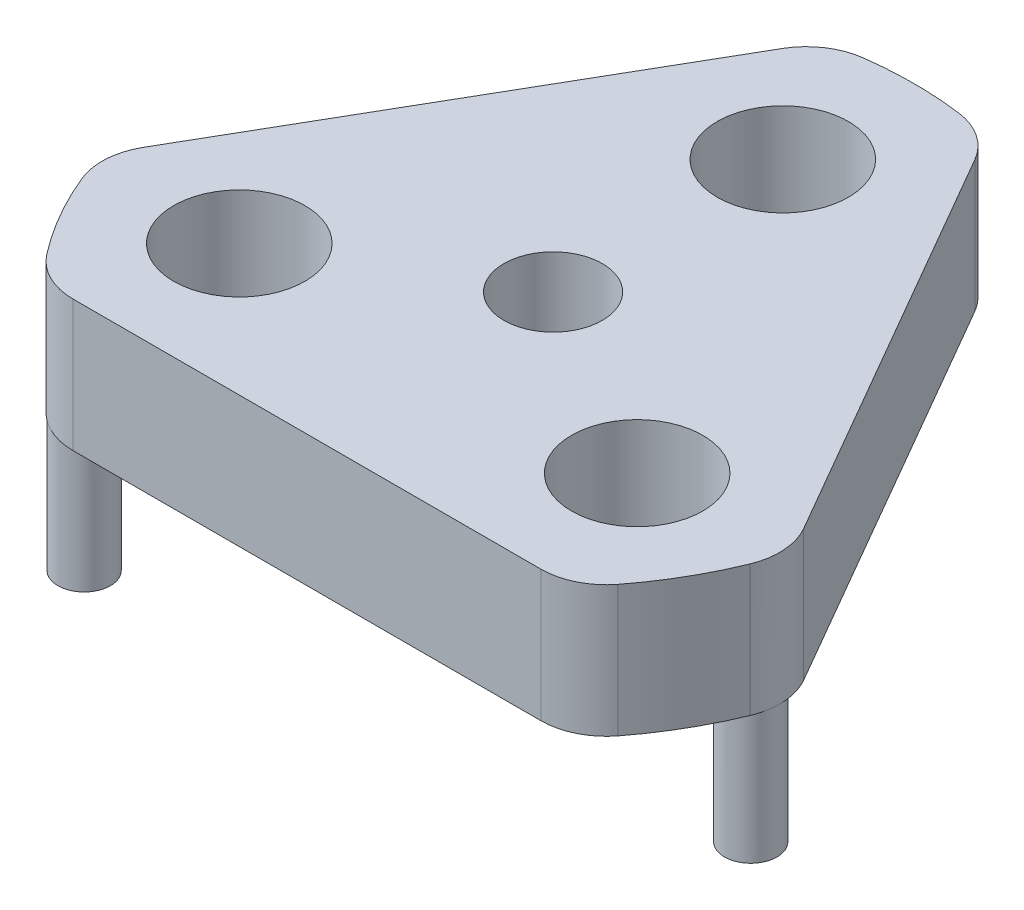
from build123d import *

# Parameters (mm, degrees)
CROQUIS1_R              = 5
CROQUIS1_R_2            = 3.75
SALIENTE_EXTRUIR3_DEPTH = 10
REDONDEO3_R             = 5
CROQUIS3_R              = 2
SALIENTE_EXTRUIR4_DEPTH = 10


with BuildPart() as part:
    # Croquis1 → Saliente-Extruir3 (new body)
    # profile 1 of 5: a face of its own
    with BuildSketch(Plane(origin=(0, 0, 0), x_dir=(1, 0, 0), z_dir=(0, 1, 0))):
        with BuildLine():
            ThreePointArc((6.179553234, 26.796699831), (0, 27.5), (-6.179553234, 26.796699831))
            Line((-6.179553234, 26.796699831), (-26.296399408, -8.046699831))
            ThreePointArc((-26.296399408, -8.046699831), (-23.815698604, -13.75), (-20.116846174, -18.75))
            Line((-20.116846174, -18.75), (20.116846174, -18.75))
            ThreePointArc((20.116846174, -18.75), (23.815698604, -13.75), (26.296399408, -8.046699831))
            Line((26.296399408, -8.046699831), (6.179553234, 26.796699831))
        make_face()
        with Locations(Location((-15.155444566, -8.75, 0), (0, 0, 270))):
            Circle(CROQUIS1_R, mode=Mode.SUBTRACT)
        with Locations(Location((15.155444566, -8.75, 0), (0, 0, 270))):
            Circle(CROQUIS1_R, mode=Mode.SUBTRACT)
        with BuildLine():
            ThreePointArc((0, 7.5), (2.053290038, 7.406507449), (3.995190528, 8.080127019))
            ThreePointArc((3.995190528, 8.080127019), (1.58501754, 10.938896501), (-1.666208496, 12.785792829))
            ThreePointArc((-1.666208496, 12.785792829), (-4.714207171, 19.166208496), (1.666208496, 22.214207171))
            ThreePointArc((1.666208496, 22.214207171), (7.977102724, 18.629231149), (12.655444566, 13.080127019))
            Line((12.655444566, 13.080127019), (17.655444566, 4.419872981))
            Line((17.655444566, 4.419872981), (8.995190528, -0.580127019))
            ThreePointArc((8.995190528, -0.580127019), (7.440868623, -1.92505239), (6.495190528, -3.75))
            ThreePointArc((6.495190528, -3.75), (0, -6.171567416), (-6.495190528, -3.75))
            ThreePointArc((-6.495190528, -3.75), (-5.344734164, 3.085783708), (0, 7.5))
        make_face(mode=Mode.SUBTRACT)
    # profile 2 of 5: a face of its own
    with BuildSketch(Plane(origin=(0, 0, 0), x_dir=(1, 0, 0), z_dir=(0, 1, 0))):
        with BuildLine():
            ThreePointArc((0, 7.5), (5.344734164, 3.085783708), (6.495190528, -3.75))
            ThreePointArc((6.495190528, -3.75), (0, -6.171567416), (-6.495190528, -3.75))
            ThreePointArc((-6.495190528, -3.75), (-5.344734164, 3.085783708), (0, 7.5))
        make_face()
        with Locations(Location((0, 0, 0), (0, 0, 270))):
            Circle(CROQUIS1_R_2, mode=Mode.SUBTRACT)
    # profile 3 of 5: a face of its own
    with BuildSketch(Plane(origin=(0, 0, 0), x_dir=(1, 0, 0), z_dir=(0, 1, 0))):
        with BuildLine():
            ThreePointArc((8.995190528, -0.580127019), (7.440868623, -1.92505239), (6.495190528, -3.75))
            ThreePointArc((6.495190528, -3.75), (5.344734164, 3.085783708), (0, 7.5))
            ThreePointArc((0, 7.5), (2.053290038, 7.406507449), (3.995190528, 8.080127019))
            Line((3.995190528, 8.080127019), (8.995190528, -0.580127019))
        make_face()
    # profile 4 of 5: a face of its own
    with BuildSketch(Plane(origin=(0, 0, 0), x_dir=(1, 0, 0), z_dir=(0, 1, 0))):
        Polygon((17.655444566, 4.419872981), (8.995190528, -0.580127019), (3.995190528, 8.080127019), (12.655444566, 13.080127019), align=None)
    # profile 5 of 5: a face of its own
    with BuildSketch(Plane(origin=(0, 0, 0), x_dir=(1, 0, 0), z_dir=(0, 1, 0))):
        with BuildLine():
            ThreePointArc((-1.666208496, 12.785792829), (1.58501754, 10.938896501), (3.995190528, 8.080127019))
            Line((3.995190528, 8.080127019), (12.655444566, 13.080127019))
            ThreePointArc((12.655444566, 13.080127019), (7.977102724, 18.629231149), (1.666208496, 22.214207171))
            ThreePointArc((1.666208496, 22.214207171), (4.082342617, 20.386949733), (5, 17.5))
            ThreePointArc((5, 17.5), (2.886949733, 13.417657383), (-1.666208496, 12.785792829))
        make_face()
    extrude(amount=SALIENTE_EXTRUIR3_DEPTH)

    # Redondeo3
    redondeo3_edges = [part.edges().sort_by_distance(p)[0] for p in [
        (-20.116846174, 5, 18.75),
        (-26.296399408, 5, 8.046699831),
        (-6.179553234, 5, -26.796699831),
        (6.179553234, 5, -26.796699831),
        (26.296399408, 5, 8.046699831),
        (20.116846174, 5, 18.75),
    ]]
    fillet(redondeo3_edges, radius=REDONDEO3_R)

    # Croquis3 → Saliente-Extruir4 (add)
    with BuildSketch(Plane.XZ):
        with Locations(Location((23.805967574, 8.75, 0), (0, 0, 3.846633593))):
            Circle(CROQUIS3_R)
        with Locations(Location((-4.325261504, -24.99157268, 0), (0, 0, 243.846633832))):
            Circle(CROQUIS3_R)
        with Locations(Location((-19.48070607, 16.24157268, 0), (0, 0, 123.846633623))):
            Circle(CROQUIS3_R)
    extrude(amount=SALIENTE_EXTRUIR4_DEPTH)


solid = part.part
